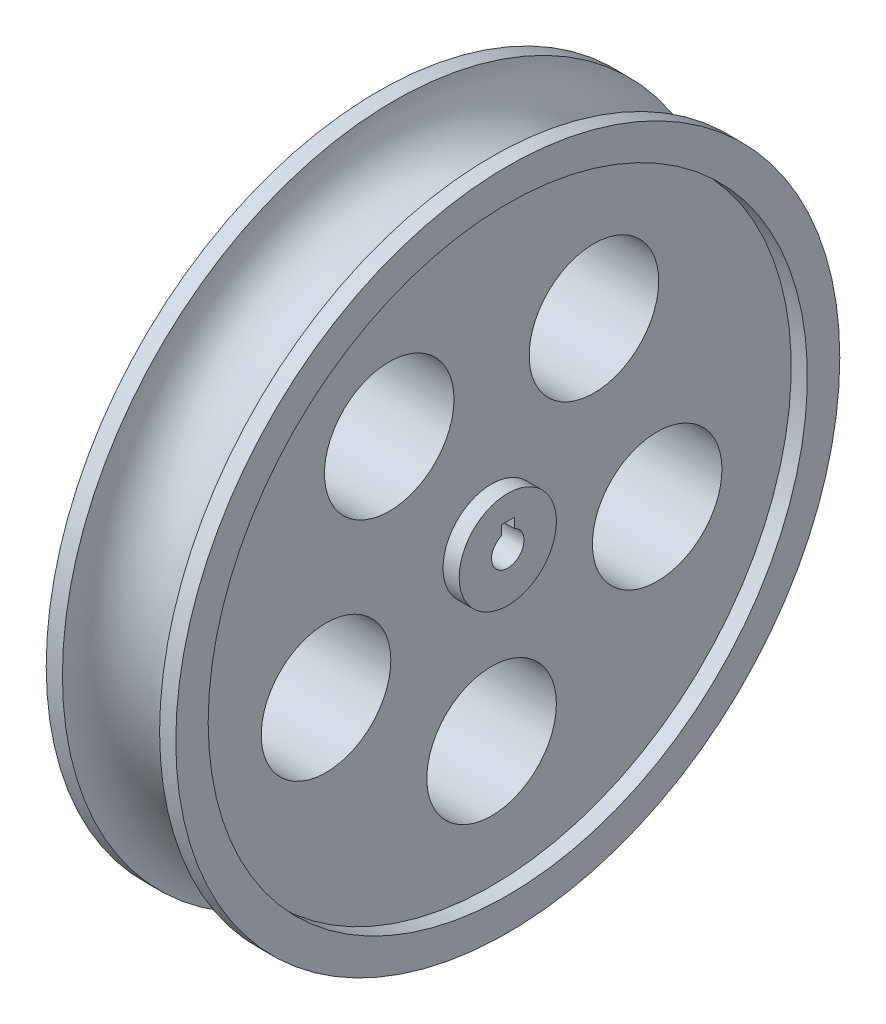
from build123d import *

# Parameters (mm, degrees)
SKETCH2_W          = 20
SKETCH2_H          = 15
CUT_EXTRUDE1_DEPTH = 200
SKETCH3_R          = 100
CUT_EXTRUDE2_DEPTH = 200


with BuildPart() as part:
    # Sketch1 → Revolve2 (revolve)
    with BuildSketch(Plane.XY, mode=Mode.PRIVATE) as revolve2_sk:
        with BuildLine():
            Line((-75, 25), (75, 25))
            Line((75, 25), (100, 25))
            Line((100, 25), (100, 75))
            Line((100, 75), (75, 75))
            Line((75, 75), (75, 462.5))
            Line((75, 462.5), (100, 462.5))
            Line((100, 462.5), (100, 512.5))
            Line((100, 512.5), (75, 512.5))
            ThreePointArc((75, 512.5), (0, 437.5), (-75, 512.5))
            Line((-75, 512.5), (-100, 512.5))
            Line((-100, 512.5), (-100, 462.5))
            Line((-100, 462.5), (-75, 462.5))
            Line((-75, 462.5), (-75, 75))
            Line((-75, 75), (-100, 75))
            Line((-100, 75), (-100, 25))
            Line((-100, 25), (-75, 25))
        make_face()
    revolve(revolve2_sk.sketch.rotate(Axis((-60.76079066, 0, 0), (1, 0, 0)), 90), axis=Axis((-60.76079066, 0, 0), (1, 0, 0)))

    # Sketch2 → Cut-Extrude1 (cut)
    with BuildSketch(Plane(origin=(100, 0, 0), x_dir=(0, 0, -1), z_dir=(1, 0, 0))):
        with Locations((0, 30.412878475)):
            Rectangle(SKETCH2_W, SKETCH2_H)
    extrude(amount=-CUT_EXTRUDE1_DEPTH, mode=Mode.SUBTRACT)

    # Sketch3 → Cut-Extrude2 (cut)
    with BuildSketch(Plane(origin=(75, 0, 0), x_dir=(0, 0, -1), z_dir=(1, 0, 0))):
        with Locations((0, -268.75)):
            Circle(SKETCH3_R)
        with Locations((-255.596438754, -83.048317238)):
            Circle(SKETCH3_R)
        with Locations((-157.967286554, 217.423317238)):
            Circle(SKETCH3_R)
        with Locations((157.967286554, 217.423317238)):
            Circle(SKETCH3_R)
        with Locations((255.596438754, -83.048317238)):
            Circle(SKETCH3_R)
    extrude(amount=-CUT_EXTRUDE2_DEPTH, mode=Mode.SUBTRACT)


solid = part.part
